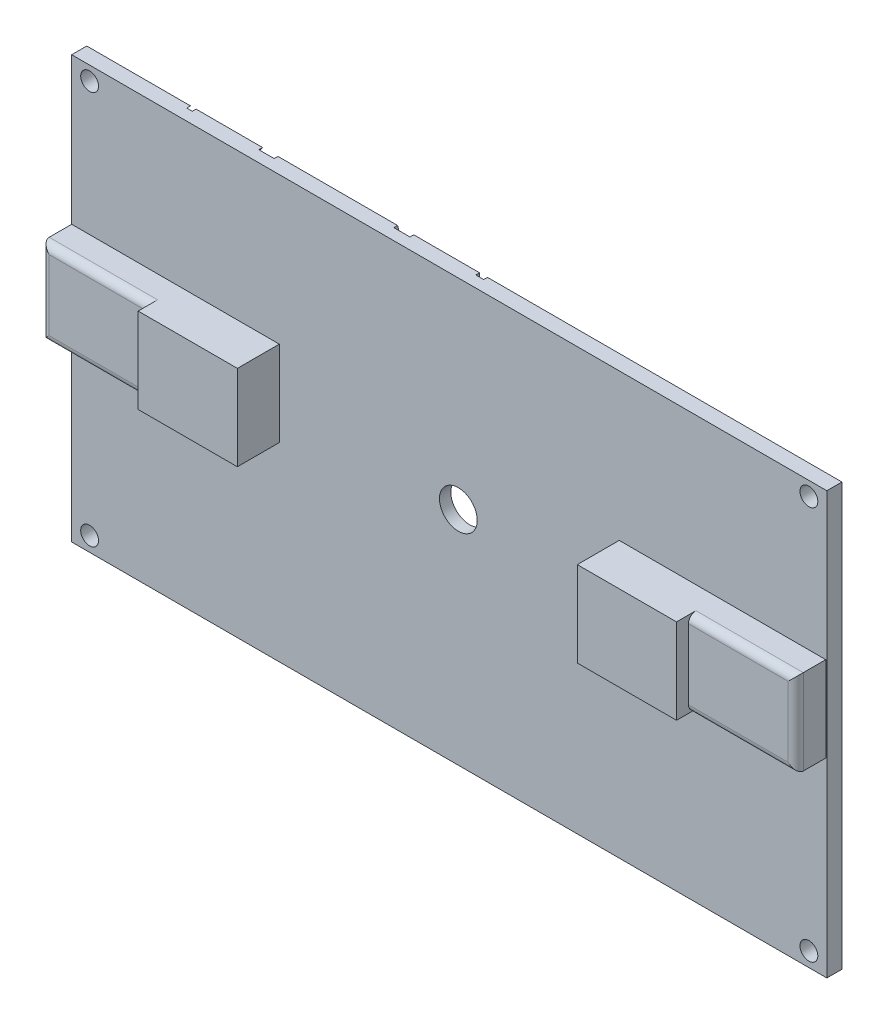
from build123d import *

# Parameters (mm, degrees)
SKETCH1_W           = 127
SKETCH1_H           = 70.970672536
SKETCH1_R           = 1.5
BOSS_EXTRUDE1_DEPTH = 2.54
SKETCH2_W           = 16.687372795
SKETCH2_H           = 14.334890166
BOSS_EXTRUDE2_DEPTH = 7.05
CUT_EXTRUDE1_DEPTH  = 0.635
CUT_EXTRUDE3_DEPTH  = 0.635
SKETCH9_R           = 3.175000006
CUT_EXTRUDE4_DEPTH  = 5.08
SKETCH2_4_W         = 18.228364853
SKETCH2_4_H         = 14.334890166
SKETCH2_4_W_2       = 18.047216703
BOSS_EXTRUDE3_DEPTH = 5.05
FILLET1_R           = 1.27


with BuildPart() as part:
    # Sketch1 → Boss-Extrude1 (new body)
    with BuildSketch(Plane.XY):
        with Locations((0, -1.27)):
            Rectangle(SKETCH1_W, SKETCH1_H)
        with Locations((-60.48290343, 31.874217243)):
            Circle(SKETCH1_R, mode=Mode.SUBTRACT)
        with Locations((60.48290343, 31.874217243)):
            Circle(SKETCH1_R, mode=Mode.SUBTRACT)
        with Locations((60.48290343, -34.303923856)):
            Circle(SKETCH1_R, mode=Mode.SUBTRACT)
        with Locations((-60.48290343, -34.303923856)):
            Circle(SKETCH1_R, mode=Mode.SUBTRACT)
    extrude(amount=BOSS_EXTRUDE1_DEPTH)

    # Sketch2 → Boss-Extrude2 (add)
    with BuildSketch(Plane.XY.offset(2.54)):
        with Locations((-36.92794875, 2.353675994)):
            Rectangle(SKETCH2_W, SKETCH2_H)
        with Locations((36.92794875, 2.353675994)):
            Rectangle(SKETCH2_W, SKETCH2_H)
    extrude(amount=BOSS_EXTRUDE2_DEPTH)

    # Sketch5 → Cut-Extrude1 (cut)
    with BuildSketch(Plane(origin=(0, 0, 0), x_dir=(-1, 0, 0), z_dir=(0, 0, -1))):
        with BuildLine():
            add(Edge.make_bspline(
                [(-33.188510602, -17.142988209), (-34.193207602, -17.010324009), (-34.711615252, -16.853485359), (-35.622090952, -16.409772759)],
                knots=[0, 0, 0, 0, 0.058823529, 0.058823529, 0.058823529, 0.058823529], degree=3))
            add(Edge.make_bspline(
                [(-35.622090952, -16.409772759), (-36.890935252, -15.790590609), (-39.189927352, -14.087901609), (-40.211883652, -13.011805209)],
                knots=[0.058823529, 0.058823529, 0.058823529, 0.058823529, 0.117647059, 0.117647059, 0.117647059, 0.117647059], degree=3))
            add(Edge.make_bspline(
                [(-40.211883652, -13.011805209), (-42.099833902, -11.024090109), (-43.428380902, -8.812689909), (-44.593345552, -6.058840959)],
                knots=[0.117647059, 0.117647059, 0.117647059, 0.117647059, 0.176470588, 0.176470588, 0.176470588, 0.176470588], degree=3))
            add(Edge.make_bspline(
                [(-44.593345552, -6.058840959), (-46.483753252, -1.590244359), (-46.988178202, 2.098711941), (-46.991626252, 7.242269091)],
                knots=[0.176470588, 0.176470588, 0.176470588, 0.176470588, 0.235294118, 0.235294118, 0.235294118, 0.235294118], degree=3))
            add(Edge.make_bspline(
                [(-46.991626252, 7.242269091), (-46.992940702, 9.194093991), (-46.938362452, 10.336808241), (-46.670157502, 11.928188091)],
                knots=[0.235294118, 0.235294118, 0.235294118, 0.235294118, 0.294117647, 0.294117647, 0.294117647, 0.294117647], degree=3))
            add(Edge.make_bspline(
                [(-46.670157502, 11.928188091), (-46.227092602, 14.559355041), (-45.489057502, 16.655693241), (-44.188914052, 18.975240291)],
                knots=[0.294117647, 0.294117647, 0.294117647, 0.294117647, 0.352941176, 0.352941176, 0.352941176, 0.352941176], degree=3))
            add(Edge.make_bspline(
                [(-44.188914052, 18.975240291), (-42.180186802, 22.558907241), (-39.574489702, 24.332881341), (-35.406216352, 25.124256441)],
                knots=[0.352941176, 0.352941176, 0.352941176, 0.352941176, 0.411764706, 0.411764706, 0.411764706, 0.411764706], degree=3))
            add(Edge.make_bspline(
                [(-35.406216352, 25.124256441), (-32.345014702, 25.705452891), (-28.242101902, 25.231507941), (-25.781146702, 24.013736691)],
                knots=[0.411764706, 0.411764706, 0.411764706, 0.411764706, 0.470588235, 0.470588235, 0.470588235, 0.470588235], degree=3))
            add(Edge.make_bspline(
                [(-25.781146702, 24.013736691), (-23.491603402, 22.880776041), (-21.292776202, 20.156035491), (-20.271905752, 17.572836441)],
                knots=[0.470588235, 0.470588235, 0.470588235, 0.470588235, 0.529411765, 0.529411765, 0.529411765, 0.529411765], degree=3))
            add(Edge.make_bspline(
                [(-20.271905752, 17.572836441), (-19.484512102, 15.579577791), (-18.883370302, 13.105058991), (-18.698794852, 11.097341391)],
                knots=[0.529411765, 0.529411765, 0.529411765, 0.529411765, 0.588235294, 0.588235294, 0.588235294, 0.588235294], degree=3))
            add(Edge.make_bspline(
                [(-18.698794852, 11.097341391), (-18.611012452, 10.146593991), (-18.576608152, 5.676492441), (-18.646293052, 4.364976141)],
                knots=[0.588235294, 0.588235294, 0.588235294, 0.588235294, 0.647058824, 0.647058824, 0.647058824, 0.647058824], degree=3))
            add(Edge.make_bspline(
                [(-18.646293052, 4.364976141), (-18.845575102, 0.631499991), (-19.509924802, -2.736235209), (-20.751680002, -6.313120359)],
                knots=[0.647058824, 0.647058824, 0.647058824, 0.647058824, 0.705882353, 0.705882353, 0.705882353, 0.705882353], degree=3))
            add(Edge.make_bspline(
                [(-20.751680002, -6.313120359), (-21.668632702, -8.952631209), (-22.446387052, -10.350196359), (-23.955432802, -12.067820559)],
                knots=[0.705882353, 0.705882353, 0.705882353, 0.705882353, 0.764705882, 0.764705882, 0.764705882, 0.764705882], degree=3))
            add(Edge.make_bspline(
                [(-23.955432802, -12.067820559), (-25.701689152, -14.055116559), (-26.815047352, -14.758690209), (-28.754546902, -16.065444009)],
                knots=[0.764705882, 0.764705882, 0.764705882, 0.764705882, 0.823529412, 0.823529412, 0.823529412, 0.823529412], degree=3))
            add(Edge.make_bspline(
                [(-28.754546902, -16.065444009), (-29.640200452, -16.661537559), (-30.270926902, -16.920865209), (-31.135396852, -17.044709259)],
                knots=[0.823529412, 0.823529412, 0.823529412, 0.823529412, 0.882352941, 0.882352941, 0.882352941, 0.882352941], degree=3))
            add(Edge.make_bspline(
                [(-31.135396852, -17.044709259), (-31.639993252, -17.117632659), (-32.919315052, -17.178287859), (-33.188510602, -17.142988209)],
                knots=[0.882352941, 0.882352941, 0.882352941, 0.882352941, 1, 1, 1, 1], degree=3))
        make_face()
        with BuildLine():
            add(Edge.make_bspline(
                [(-39.126719452, -5.554473159), (-36.862245952, -5.086948059), (-35.389966702, -1.957414059), (-36.115752652, 0.063924291)],
                knots=[0, 0, 0, 0, 0.125, 0.125, 0.125, 0.125], degree=3))
            add(Edge.make_bspline(
                [(-36.115752652, 0.063924291), (-36.450423052, 0.996421791), (-36.988356952, 1.882303941), (-37.936627852, 3.061689441)],
                knots=[0.125, 0.125, 0.125, 0.125, 0.25, 0.25, 0.25, 0.25], degree=3))
            add(Edge.make_bspline(
                [(-37.936627852, 3.061689441), (-39.604893502, 5.137834641), (-41.034081652, 6.411498591), (-43.462232752, 7.902580191)],
                knots=[0.25, 0.25, 0.25, 0.25, 0.375, 0.375, 0.375, 0.375], degree=3))
            add(Edge.make_bspline(
                [(-43.462232752, 7.902580191), (-45.297224002, 9.029406741), (-45.186695902, 9.965771391), (-45.435736552, 10.232890491)],
                knots=[0.375, 0.375, 0.375, 0.375, 0.5, 0.5, 0.5, 0.5], degree=3))
            add(Edge.make_bspline(
                [(-45.435736552, 10.232890491), (-45.482332852, 10.282001391), (-45.632504002, 9.859529541), (-45.812183602, 9.170643441)],
                knots=[0.5, 0.5, 0.5, 0.5, 0.625, 0.625, 0.625, 0.625], degree=3))
            add(Edge.make_bspline(
                [(-45.812183602, 9.170643441), (-46.342802302, 7.130731341), (-46.465827202, 5.267241291), (-46.190383252, 3.411961791)],
                knots=[0.625, 0.625, 0.625, 0.625, 0.75, 0.75, 0.75, 0.75], degree=3))
            add(Edge.make_bspline(
                [(-46.190383252, 3.411961791), (-45.711599602, 0.192302241), (-43.637226052, -6.483522609), (-39.126719452, -5.554473159)],
                knots=[0.75, 0.75, 0.75, 0.75, 1, 1, 1, 1], degree=3))
        make_face(mode=Mode.SUBTRACT)
        with BuildLine():
            add(Edge.make_bspline(
                [(-24.700211602, -5.405197359), (-20.357135452, -4.364743509), (-18.908192452, 3.579258891), (-19.561588402, 7.444046691)],
                knots=[0, 0, 0, 0, 0.125, 0.125, 0.125, 0.125], degree=3))
            add(Edge.make_bspline(
                [(-19.561588402, 7.444046691), (-19.770928852, 8.682106191), (-20.131069102, 9.931595691), (-20.477055202, 10.614176241)],
                knots=[0.125, 0.125, 0.125, 0.125, 0.25, 0.25, 0.25, 0.25], degree=3))
            add(Edge.make_bspline(
                [(-20.477055202, 10.614176241), (-20.825079652, 9.238861491), (-21.195392602, 8.959702791), (-22.722669202, 7.901741991)],
                knots=[0.25, 0.25, 0.25, 0.25, 0.375, 0.375, 0.375, 0.375], degree=3))
            add(Edge.make_bspline(
                [(-22.722669202, 7.901741991), (-25.215399802, 6.175145241), (-28.061622202, 2.612661891), (-28.883229652, 0.160755441)],
                knots=[0.375, 0.375, 0.375, 0.375, 0.5, 0.5, 0.5, 0.5], degree=3))
            add(Edge.make_bspline(
                [(-28.883229652, 0.160755441), (-29.431050502, -1.474706109), (-29.244227152, -2.777173659), (-28.276258552, -4.061791359)],
                knots=[0.5, 0.5, 0.5, 0.5, 0.625, 0.625, 0.625, 0.625], degree=3))
            add(Edge.make_bspline(
                [(-28.276258552, -4.061791359), (-27.699634102, -4.826915559), (-27.049133752, -5.310918909), (-26.398061902, -5.459375559)],
                knots=[0.625, 0.625, 0.625, 0.625, 0.75, 0.75, 0.75, 0.75], degree=3))
            add(Edge.make_bspline(
                [(-26.398061902, -5.459375559), (-26.017366702, -5.546262609), (-25.179985852, -5.519192559), (-24.700211602, -5.405197359)],
                knots=[0.75, 0.75, 0.75, 0.75, 1, 1, 1, 1], degree=3))
        make_face(mode=Mode.SUBTRACT)
    extrude(amount=-CUT_EXTRUDE1_DEPTH, mode=Mode.SUBTRACT)

    # Sketch8 → Cut-Extrude3 (cut)
    with BuildSketch(Plane(origin=(0, 0, 0), x_dir=(-1, 0, 0), z_dir=(0, 0, -1))):
        with BuildLine():
            Line((1.302964158, 5.9086), (-7.279235842, 5.7223))
            add(Edge.make_bspline(
                [(-7.279235842, 5.7223), (-7.977935842, 6.7889), (-8.861335842, 7.1465), (-8.896435842, 10.7591)],
                knots=[0.888888889, 0.888888889, 0.888888889, 0.888888889, 1, 1, 1, 1], degree=3))
            add(Edge.make_bspline(
                [(-8.896435842, 10.7591), (-8.694935842, 18.9537), (-5.217035842, 25.3707), (-2.801435842, 32.7134)],
                knots=[0.777777778, 0.777777778, 0.777777778, 0.777777778, 0.888888889, 0.888888889, 0.888888889, 0.888888889], degree=3))
            add(Edge.make_bspline(
                [(-2.801435842, 32.7134), (-1.994735842, 34.8532), (-3.126435842, 35.2259), (-4.418635842, 33.6777)],
                knots=[0.666666667, 0.666666667, 0.666666667, 0.666666667, 0.777777778, 0.777777778, 0.777777778, 0.777777778], degree=3))
            add(Edge.make_bspline(
                [(-4.418635842, 33.6777), (-10.300935842, 26.9649), (-11.854835842, 21.3338), (-13.132435842, 15.7718)],
                knots=[0.555555556, 0.555555556, 0.555555556, 0.555555556, 0.666666667, 0.666666667, 0.666666667, 0.666666667], degree=3))
            add(Edge.make_bspline(
                [(-13.132435842, 15.7718), (-13.746235842, 8.9899), (-14.737735842, 5.7475), (-12.766135842, 3.3302)],
                knots=[0.444444444, 0.444444444, 0.444444444, 0.444444444, 0.555555556, 0.555555556, 0.555555556, 0.555555556], degree=3))
            add(Edge.make_bspline(
                [(-12.766135842, 3.3302), (-10.745235842, 0.8524), (-6.375135842, 0.8239), (-1.346735842, 0.908)],
                knots=[0.333333333, 0.333333333, 0.333333333, 0.333333333, 0.444444444, 0.444444444, 0.444444444, 0.444444444], degree=3))
            add(Edge.make_bspline(
                [(-1.346735842, 0.908), (-7.628235842, -0.725), (-17.572335842, -1.6157), (-18.761935842, -4.2815)],
                knots=[0.222222222, 0.222222222, 0.222222222, 0.222222222, 0.333333333, 0.333333333, 0.333333333, 0.333333333], degree=3))
            add(Edge.make_bspline(
                [(-18.761935842, -4.2815), (-20.168135842, -14.5007), (-10.493635842, -26.6685), (-4.733235842, -34.5823)],
                knots=[0.111111111, 0.111111111, 0.111111111, 0.111111111, 0.222222222, 0.222222222, 0.222222222, 0.222222222], degree=3))
            add(Edge.make_bspline(
                [(-4.733235842, -34.5823), (-3.961735842, -35.8934), (-0.894735842, -37.758), (-3.017735842, -33.2625)],
                knots=[0, 0, 0, 0, 0.111111111, 0.111111111, 0.111111111, 0.111111111], degree=3))
            Line((-3.017735842, -33.2625), (-10.625435842, -16.991))
            add(Edge.make_bspline(
                [(-10.625435842, -16.991), (-13.352235842, -12.2673), (-14.614635842, -9.0988), (-14.360035842, -8.388)],
                knots=[0.916666667, 0.916666667, 0.916666667, 0.916666667, 1, 1, 1, 1], degree=3))
            add(Edge.make_bspline(
                [(-14.360035842, -8.388), (-13.792435842, -6.8067), (-9.648135842, -5.9319), (-4.249535842, -5.9088)],
                knots=[0.833333333, 0.833333333, 0.833333333, 0.833333333, 0.916666667, 0.916666667, 0.916666667, 0.916666667], degree=3))
            add(Edge.make_bspline(
                [(-4.249535842, -5.9088), (-5.807935842, -17.3361), (1.680664158, -26.2181), (5.557964158, -32.4275)],
                knots=[0.75, 0.75, 0.75, 0.75, 0.833333333, 0.833333333, 0.833333333, 0.833333333], degree=3))
            add(Edge.make_bspline(
                [(5.557964158, -32.4275), (6.828664158, -34.6696), (8.914464158, -34.8012), (7.360764158, -31.2846)],
                knots=[0.666666667, 0.666666667, 0.666666667, 0.666666667, 0.75, 0.75, 0.75, 0.75], degree=3))
            add(Edge.make_bspline(
                [(7.360764158, -31.2846), (5.058464158, -25.5487), (2.319864158, -20.2054), (1.582964158, -13.0612)],
                knots=[0.583333333, 0.583333333, 0.583333333, 0.583333333, 0.666666667, 0.666666667, 0.666666667, 0.666666667], degree=3))
            add(Edge.make_bspline(
                [(1.582964158, -13.0612), (0.182464158, -6.4084), (2.061864158, -3.3567), (7.460664158, -4.1672)],
                knots=[0.5, 0.5, 0.5, 0.5, 0.583333333, 0.583333333, 0.583333333, 0.583333333], degree=3))
            add(Edge.make_bspline(
                [(7.460664158, -4.1672), (5.826264158, -17.9031), (12.744564158, -29.6054), (20.030064158, -30.2282)],
                knots=[0.416666667, 0.416666667, 0.416666667, 0.416666667, 0.5, 0.5, 0.5, 0.5], degree=3))
            add(Edge.make_bspline(
                [(20.030064158, -30.2282), (26.009364158, -30.7387), (36.466664158, -21.3611), (34.187164158, -4.3693)],
                knots=[0.333333333, 0.333333333, 0.333333333, 0.333333333, 0.416666667, 0.416666667, 0.416666667, 0.416666667], degree=3))
            add(Edge.make_bspline(
                [(34.187164158, -4.3693), (36.204164158, -4.651), (39.815964158, -4.0523), (40.256164158, -7.2721)],
                knots=[0.25, 0.25, 0.25, 0.25, 0.333333333, 0.333333333, 0.333333333, 0.333333333], degree=3))
            add(Edge.make_bspline(
                [(40.256164158, -7.2721), (41.173564158, -15.469), (37.887964158, -23.3035), (33.799264158, -31.0347)],
                knots=[0.166666667, 0.166666667, 0.166666667, 0.166666667, 0.25, 0.25, 0.25, 0.25], degree=3))
            add(Edge.make_bspline(
                [(33.799264158, -31.0347), (32.372564158, -33.7185), (33.093364158, -36.3176), (35.696464158, -32.5274)],
                knots=[0.083333333, 0.083333333, 0.083333333, 0.083333333, 0.166666667, 0.166666667, 0.166666667, 0.166666667], degree=3))
            add(Edge.make_bspline(
                [(35.696464158, -32.5274), (42.379364158, -24.0846), (47.088764158, -15.4848), (46.020364158, -6.2198)],
                knots=[0, 0, 0, 0, 0.083333333, 0.083333333, 0.083333333, 0.083333333], degree=3))
            Line((46.020364158, -6.2198), (52.550864158, -7.2142))
            add(Edge.make_bspline(
                [(52.550864158, -7.2142), (56.148564158, -7.4643), (56.748064158, -9.313), (55.069864158, -12.3768)],
                knots=[0, 0, 0, 0, 1, 1, 1, 1], degree=3))
            Line((55.069864158, -12.3768), (43.750564158, -34.3309))
            add(Edge.make_bspline(
                [(43.750564158, -34.3309), (42.880664158, -36.3746), (43.460264158, -37.8135), (45.616764158, -35.5754)],
                knots=[0, 0, 0, 0, 1, 1, 1, 1], degree=3))
            Line((45.616764158, -35.5754), (56.351464158, -20.3776))
            add(Edge.make_bspline(
                [(56.351464158, -20.3776), (60.460664158, -13.1128), (60.978464158, -8.5674), (60.452664158, -5.437)],
                knots=[0.833333333, 0.833333333, 0.833333333, 0.833333333, 1, 1, 1, 1], degree=3))
            add(Edge.make_bspline(
                [(60.452664158, -5.437), (59.860964158, -1.9155), (50.930664158, -1.2382), (43.284264158, 0.4353)],
                knots=[0.666666667, 0.666666667, 0.666666667, 0.666666667, 0.833333333, 0.833333333, 0.833333333, 0.833333333], degree=3))
            add(Edge.make_bspline(
                [(43.284264158, 0.4353), (49.805964158, 0.6921), (53.129164158, 0.5257), (54.681364158, 2.9297)],
                knots=[0.5, 0.5, 0.5, 0.5, 0.666666667, 0.666666667, 0.666666667, 0.666666667], degree=3))
            add(Edge.make_bspline(
                [(54.681364158, 2.9297), (58.366864158, 8.6368), (53.615364158, 25.9838), (47.823964158, 32.5897)],
                knots=[0.333333333, 0.333333333, 0.333333333, 0.333333333, 0.5, 0.5, 0.5, 0.5], degree=3))
            add(Edge.make_bspline(
                [(47.823964158, 32.5897), (44.507864158, 36.3055), (44.580864158, 33.6794), (45.710364158, 30.9106)],
                knots=[0.166666667, 0.166666667, 0.166666667, 0.166666667, 0.333333333, 0.333333333, 0.333333333, 0.333333333], degree=3))
            add(Edge.make_bspline(
                [(45.710364158, 30.9106), (48.356164158, 23.8005), (54.137164158, 10.4633), (49.379164158, 5.535)],
                knots=[0, 0, 0, 0, 0.166666667, 0.166666667, 0.166666667, 0.166666667], degree=3))
            Line((49.379164158, 5.535), (40.547064158, 5.8466))
            add(Edge.make_bspline(
                [(40.547064158, 5.8466), (44.995664158, 13.0893), (40.034864158, 26.152), (33.332964158, 35.0149)],
                knots=[0.5, 0.5, 0.5, 0.5, 1, 1, 1, 1], degree=3))
            add(Edge.make_bspline(
                [(33.332964158, 35.0149), (32.583564158, 36.1603), (31.860164158, 36.7312), (31.407264158, 36.7203)],
                knots=[0, 0, 0, 0, 0.5, 0.5, 0.5, 0.5], degree=3))
            add(Edge.make_bspline(
                [(31.407264158, 36.7203), (30.825964158, 36.7051), (30.691864158, 35.7289), (31.529364158, 33.7714)],
                knots=[0, 0, 0, 0, 1, 1, 1, 1], degree=3))
            Line((31.529364158, 33.7714), (35.136464158, 22.8248))
            add(Edge.make_bspline(
                [(35.136464158, 22.8248), (38.983864158, 14.0721), (41.511564158, 6.0386), (27.611364158, 6.9659)],
                knots=[0.857142857, 0.857142857, 0.857142857, 0.857142857, 1, 1, 1, 1], degree=3))
            add(Edge.make_bspline(
                [(27.611364158, 6.9659), (34.539264158, 16.6742), (25.677764158, 22.2682), (20.911064158, 22.4345)],
                knots=[0.714285714, 0.714285714, 0.714285714, 0.714285714, 0.857142857, 0.857142857, 0.857142857, 0.857142857], degree=3))
            add(Edge.make_bspline(
                [(20.911064158, 22.4345), (16.254164158, 22.5972), (8.036464158, 15.9882), (14.302264158, 7.1522)],
                knots=[0.571428571, 0.571428571, 0.571428571, 0.571428571, 0.714285714, 0.714285714, 0.714285714, 0.714285714], degree=3))
            add(Edge.make_bspline(
                [(14.302264158, 7.1522), (7.393364158, 6.7889), (4.656364158, 8.4909), (4.082264158, 11.2638)],
                knots=[0.428571429, 0.428571429, 0.428571429, 0.428571429, 0.571428571, 0.571428571, 0.571428571, 0.571428571], degree=3))
            add(Edge.make_bspline(
                [(4.082264158, 11.2638), (2.978064158, 16.599), (9.360264158, 27.5732), (10.507964158, 32.0917)],
                knots=[0.285714286, 0.285714286, 0.285714286, 0.285714286, 0.428571429, 0.428571429, 0.428571429, 0.428571429], degree=3))
            add(Edge.make_bspline(
                [(10.507964158, 32.0917), (13.563764158, 40.0996), (9.127164158, 35.5138), (8.082664158, 33.5224)],
                knots=[0.142857143, 0.142857143, 0.142857143, 0.142857143, 0.285714286, 0.285714286, 0.285714286, 0.285714286], degree=3))
            add(Edge.make_bspline(
                [(8.082664158, 33.5224), (2.614964158, 25.7992), (-2.805235842, 13.5525), (1.302964158, 5.9086)],
                knots=[0, 0, 0, 0, 0.142857143, 0.142857143, 0.142857143, 0.142857143], degree=3))
        make_face()
    extrude(amount=-CUT_EXTRUDE3_DEPTH, mode=Mode.SUBTRACT)

    # Sketch9 → Cut-Extrude4 (cut)
    with BuildSketch(Plane.XY.offset(2.54)):
        with Locations((1.531741326, 0.496600597)):
            Circle(SKETCH9_R)
    extrude(amount=-CUT_EXTRUDE4_DEPTH, mode=Mode.SUBTRACT)

    # Sketch2<4> → Boss-Extrude3 (add)
    with BuildSketch(Plane.XY.offset(2.54)):
        with Locations((-54.385817574, 2.353675994)):
            Rectangle(SKETCH2_4_W, SKETCH2_4_H)
        with Locations((54.295243498, 2.353675994)):
            Rectangle(SKETCH2_4_W_2, SKETCH2_4_H)
    extrude(amount=BOSS_EXTRUDE3_DEPTH)

    # Fillet1
    fillet1_edges = [part.edges().sort_by_distance(p)[0] for p in [
        (-54.385817573, -4.813769089, 7.59),
        (-54.385817573, 9.521121077, 7.59),
        (-63.5, 2.353675994, 7.59),
        (63.31885185, 2.353675994, 7.59),
        (54.295243499, 9.521121077, 7.59),
        (54.295243499, -4.813769089, 7.59),
    ]]
    fillet(fillet1_edges, radius=FILLET1_R)


solid = part.part
